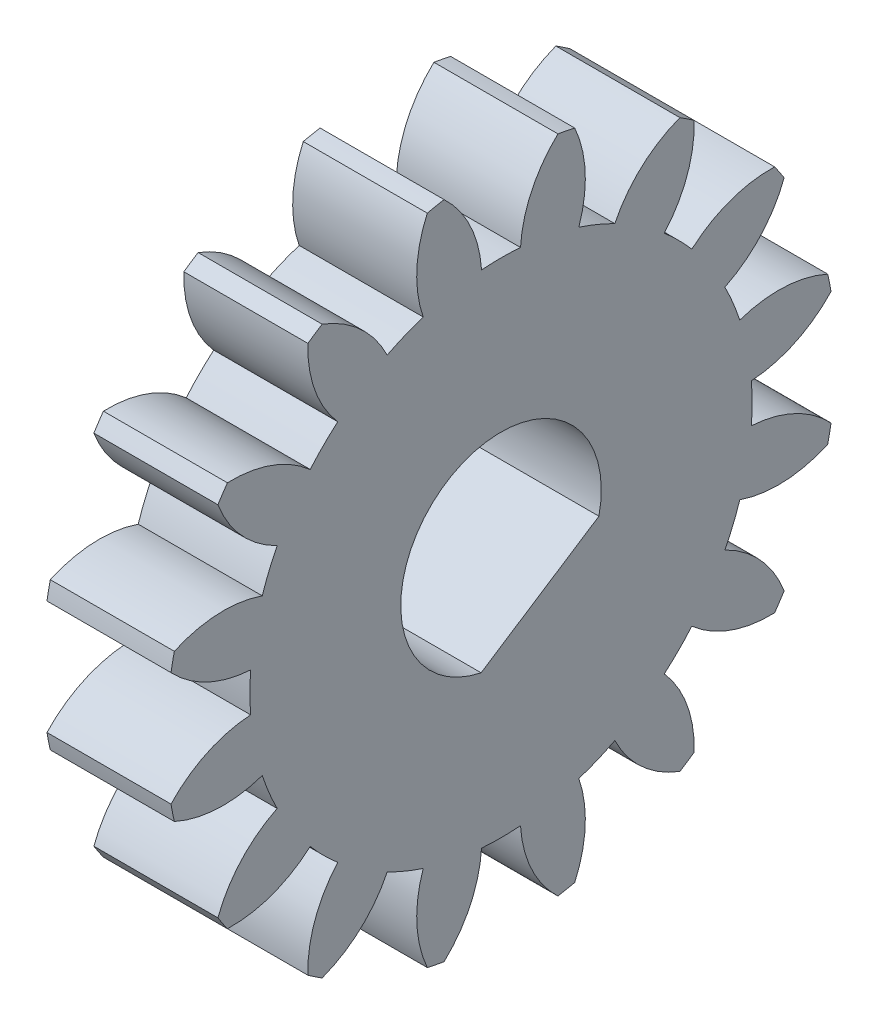
from build123d import *

# Parameters (mm, degrees)
BASPROSKE_W     = 2
BASPROSKE_H     = 8.1
TOOTHCUT_DEPTH  = 12.628413477
TEETHCUTS_COUNT = 16
TEETHCUTS_ANGLE = 337.5
BORE_DEPTH      = 50.0000508
SCALE1_SCALE_X  = 1.5
SCALE1_SCALE_Y  = 1
SCALE1_SCALE_Z  = 1


with BuildPart() as part:
    # BasProSke → Base-Revolve (revolve)
    with BuildSketch(Plane(origin=(0, 0, 0), x_dir=(1, 0, 0), z_dir=(0, 1, 0)), mode=Mode.PRIVATE) as base_revolve_sk:
        with Locations((1, 4.05)):
            Rectangle(BASPROSKE_W, BASPROSKE_H)
    revolve(base_revolve_sk.sketch.rotate(Axis((-10, 0, 0), (1, 0, 0)), 180), axis=Axis((-10, 0, 0), (1, 0, 0)))

    # TooCutSke → ToothCut (cut, through all)
    with BuildSketch(Plane(origin=(0, 0, 0), x_dir=(0, 0, -1), z_dir=(1, 0, 0))):
        with BuildLine():
            ThreePointArc((0.47111199, 6.05570223), (0, 6.074), (-0.47111199, 6.05570223))
            ThreePointArc((-0.47111199, 6.05570223), (-0.746154104, 7.120095916), (-1.399989983, 8.003883633))
            ThreePointArc((-1.399989983, 8.003883633), (0, 8.1254), (1.399989983, 8.003883633))
            ThreePointArc((1.399989983, 8.003883633), (0.746154104, 7.120095916), (0.47111199, 6.05570223))
        make_face()
    toothcut = extrude(amount=TOOTHCUT_DEPTH, mode=Mode.SUBTRACT)

    # TeethCuts: ToothCut ×16 about axis
    teethcuts_axis = Axis((-10, 0, 0), (1, 0, 0))
    for i in range(1, TEETHCUTS_COUNT):
        add(toothcut.rotate(teethcuts_axis, i * TEETHCUTS_ANGLE / (TEETHCUTS_COUNT - 1)), mode=Mode.SUBTRACT)

    # BorSke → Bore (cut, symmetric)
    with BuildSketch(Plane(origin=(0, 0, 0), x_dir=(0, 0, -1), z_dir=(1, 0, 0))):
        with BuildLine():
            Line((2.368108942, -0.522192531), (-0.48159471, -2.376697611))
            ThreePointArc((-0.48159471, -2.376697611), (-1.322698477, 2.032509223), (2.368108942, -0.522192531))
        make_face()
    extrude(amount=BORE_DEPTH, both=True, mode=Mode.SUBTRACT)


with BuildPart() as part_1:
    # Scale1: scaled about (1, -0.019840138, -0.01291139)
    add(part.part.scale((SCALE1_SCALE_X, SCALE1_SCALE_Y, SCALE1_SCALE_Z), about=(1, -0.019840138, -0.01291139)))


solid = part_1.part
